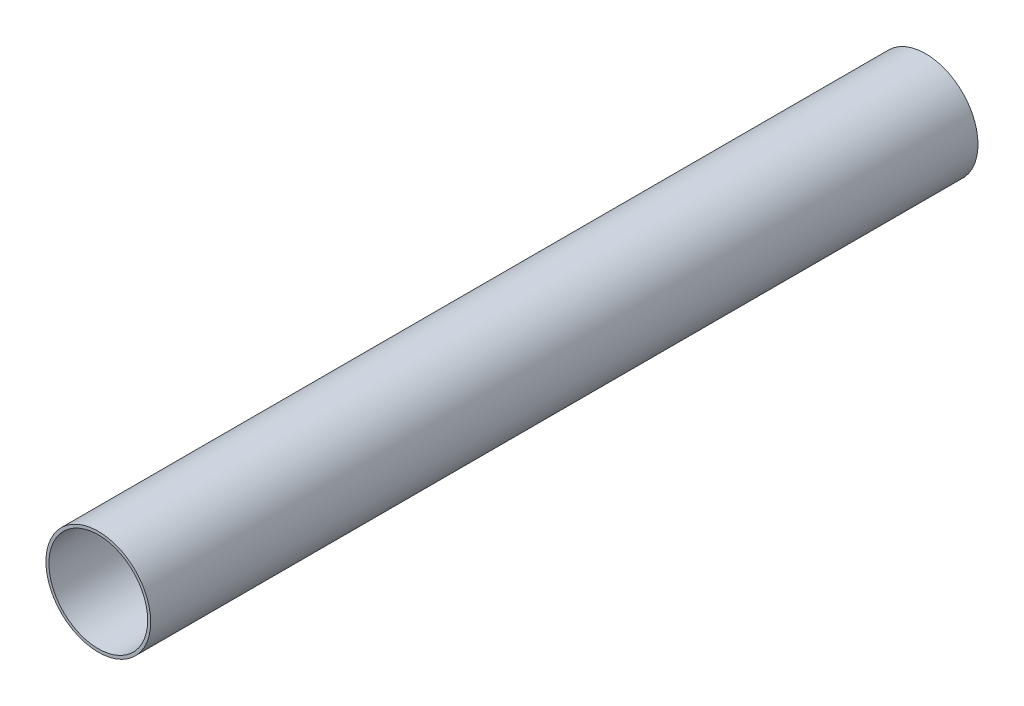
from build123d import *

# Parameters (mm, degrees)
SKETCH2_R           = 44.1325
SKETCH2_R_2         = 41.5925
BOSS_EXTRUDE1_DEPTH = 696.976


with BuildPart() as part:
    # Sketch2 → Boss-Extrude1 (new body)
    with BuildSketch(Plane.XY):
        Circle(SKETCH2_R)
        Circle(SKETCH2_R_2, mode=Mode.SUBTRACT)
    extrude(amount=BOSS_EXTRUDE1_DEPTH)


solid = part.part
